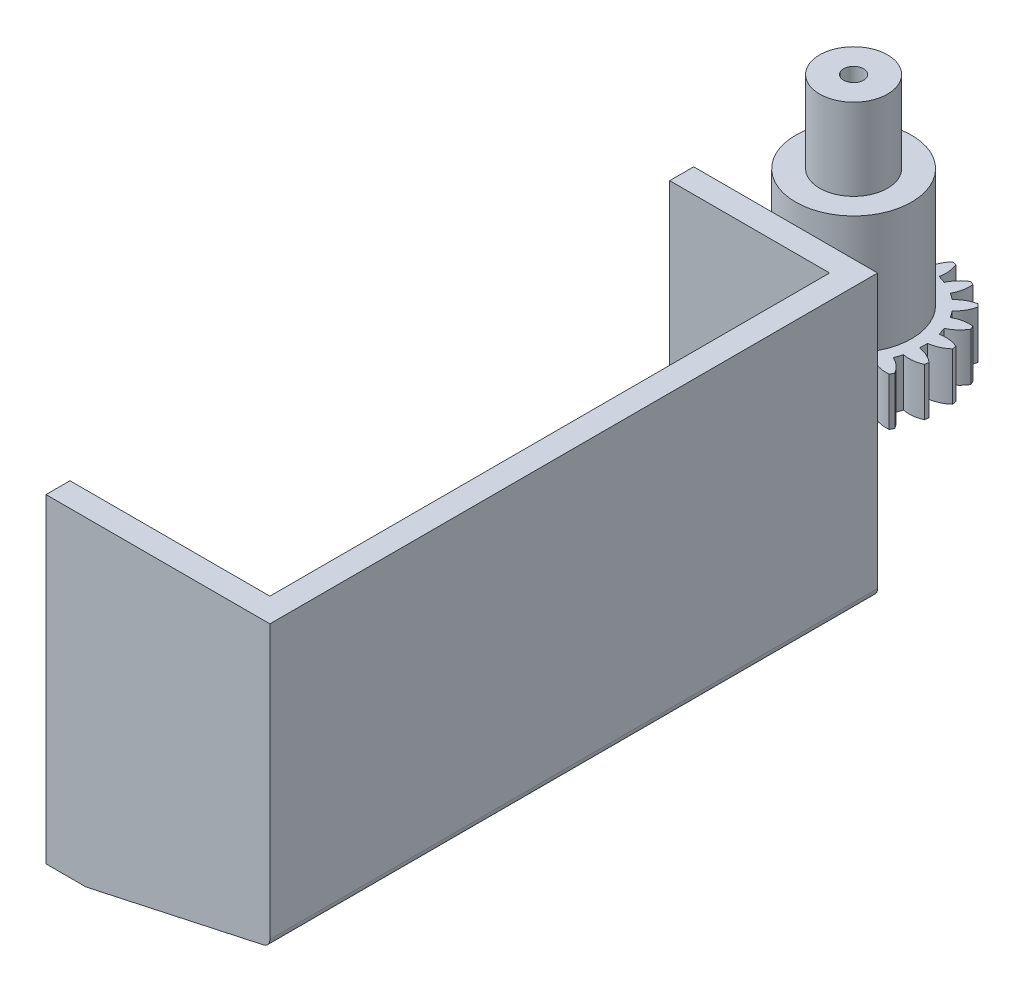
from build123d import *

# Parameters (mm, degrees)
EXTRUDE_1_DEPTH     = 6
EXTRUDE_2_DEPTH     = 20
EXTRUDE_4_DEPTH     = 6
SKETCH_5_R          = 7.25
EXTRUDE_5_DEPTH     = 14.8
SKETCH_6_R          = 4.25
SKETCH_6_R_2        = 1.25
EXTRUDE_6_DEPTH     = 10.2
EXTRUDE_7_DEPTH     = 76
CUT_EXTRUDE_1_DEPTH = 76


with BuildPart() as part:
    # 草图1 → 凸台-拉伸1 (new body)
    with BuildSketch(Plane(origin=(0, 0, 0), x_dir=(1, 0, 0), z_dir=(0, 1, 0))):
        with BuildLine():
            Line((-5, 0), (-5, -18))
            Line((-5, -18), (15, -18))
            Line((15, -18), (15, -88))
            Line((15, -88), (-10, -88))
            Line((-10, -88), (-10, -91))
            Line((-10, -91), (18, -91))
            Line((18, -91), (18, -15))
            Line((18, -15), (5, -15))
            Line((5, -15), (5, 0))
            ThreePointArc((5, 0), (0, 5), (-5, 0))
        make_face()
    extrude(amount=-EXTRUDE_1_DEPTH)

    # 草图2 → 凸台-拉伸2 (add, symmetric)
    with BuildSketch(Plane(origin=(0, 0, 0), x_dir=(1, 0, 0), z_dir=(0, 1, 0))):
        Polygon((-5, -18), (15, -18), (15, -88), (-10, -88), (-10, -91), (18, -91), (18, -15), (-5, -15), align=None)
    extrude(amount=EXTRUDE_2_DEPTH, both=True)

    # 草图4 → 凸台-拉伸4 (add)
    with BuildSketch(Plane.XZ.offset(6)):
        with BuildLine():
            ThreePointArc((-0.504732798, 8.734428762), (-0.823506466, 9.891100464), (-1.470958285, 10.901205517))
            ThreePointArc((-1.470958285, 10.901205517), (-1.726760313, 10.86362273), (-1.981608382, 10.820038273))
            ThreePointArc((-1.981608382, 10.820038273), (-2.283953757, 9.65896405), (-2.228374617, 8.460457882))
            ThreePointArc((-2.228374617, 8.460457882), (-2.708170263, 8.319303747), (-3.17911634, 8.150964378))
            ThreePointArc((-3.17911634, 8.150964378), (-3.839719327, 9.152518056), (-4.767622226, 9.913111434))
            ThreePointArc((-4.767622226, 9.913111434), (-4.999290692, 9.798320906), (-5.228197271, 9.678117239))
            ThreePointArc((-5.228197271, 9.678117239), (-5.156953143, 8.480440175), (-4.733735466, 7.357767973))
            ThreePointArc((-4.733735466, 7.357767973), (-5.146429214, 7.075257405), (-5.542305825, 6.76962681))
            ThreePointArc((-5.542305825, 6.76962681), (-6.480073708, 7.518023412), (-7.597598086, 7.954652936))
            ThreePointArc((-7.597598086, 7.954652936), (-7.782455665, 7.773891163), (-7.963013783, 7.588834659))
            ThreePointArc((-7.963013783, 7.588834659), (-7.525154025, 6.471791729), (-6.775725305, 5.53484847))
            ThreePointArc((-6.775725305, 5.53484847), (-7.080919818, 5.138635571), (-7.3629758, 4.725631002))
            ThreePointArc((-7.3629758, 4.725631002), (-8.486113324, 5.147612255), (-9.683868109, 5.217537585))
            ThreePointArc((-9.683868109, 5.217537585), (-9.803819655, 4.988498789), (-9.918355025, 4.756704069))
            ThreePointArc((-9.918355025, 4.756704069), (-9.1567404, 3.829639217), (-8.154459943, 3.170139435))
            ThreePointArc((-8.154459943, 3.170139435), (-8.322280653, 2.699008286), (-8.462906403, 2.219057507))
            ThreePointArc((-8.462906403, 2.219057507), (-9.661473042, 2.273316945), (-10.82221365, 1.969693302))
            ThreePointArc((-10.82221365, 1.969693302), (-10.86551747, 1.714797397), (-10.902818572, 1.458954141))
            ThreePointArc((-10.902818572, 1.458954141), (-9.892001226, 0.812614936), (-8.734979226, 0.495115065))
            ThreePointArc((-8.734979226, 0.495115065), (-8.748998674, -0.004816736), (-8.734428762, -0.504732798))
            ThreePointArc((-8.734428762, -0.504732798), (-9.891100464, -0.823506466), (-10.901205517, -1.470958285))
            ThreePointArc((-10.901205517, -1.470958285), (-10.86362273, -1.726760313), (-10.820038273, -1.981608382))
            ThreePointArc((-10.820038273, -1.981608382), (-9.65896405, -2.283953757), (-8.460457882, -2.228374617))
            ThreePointArc((-8.460457882, -2.228374617), (-8.319303747, -2.708170263), (-8.150964378, -3.17911634))
            ThreePointArc((-8.150964378, -3.17911634), (-9.152518056, -3.839719327), (-9.913111434, -4.767622226))
            ThreePointArc((-9.913111434, -4.767622226), (-9.798320906, -4.999290692), (-9.678117239, -5.228197271))
            ThreePointArc((-9.678117239, -5.228197271), (-8.480440175, -5.156953143), (-7.357767973, -4.733735466))
            ThreePointArc((-7.357767973, -4.733735466), (-7.075257405, -5.146429214), (-6.76962681, -5.542305825))
            ThreePointArc((-6.76962681, -5.542305825), (-7.518023412, -6.480073708), (-7.954652936, -7.597598086))
            ThreePointArc((-7.954652936, -7.597598086), (-7.773891163, -7.782455665), (-7.588834659, -7.963013783))
            ThreePointArc((-7.588834659, -7.963013783), (-6.471791729, -7.525154025), (-5.53484847, -6.775725305))
            ThreePointArc((-5.53484847, -6.775725305), (-5.138635571, -7.080919818), (-4.725631002, -7.3629758))
            ThreePointArc((-4.725631002, -7.3629758), (-5.147612255, -8.486113324), (-5.217537585, -9.683868109))
            ThreePointArc((-5.217537585, -9.683868109), (-4.988498789, -9.803819655), (-4.756704069, -9.918355025))
            ThreePointArc((-4.756704069, -9.918355025), (-3.829639217, -9.1567404), (-3.170139435, -8.154459943))
            ThreePointArc((-3.170139435, -8.154459943), (-2.699008286, -8.322280653), (-2.219057507, -8.462906403))
            ThreePointArc((-2.219057507, -8.462906403), (-2.273316945, -9.661473042), (-1.969693302, -10.82221365))
            ThreePointArc((-1.969693302, -10.82221365), (-1.714797397, -10.86551747), (-1.458954141, -10.902818572))
            ThreePointArc((-1.458954141, -10.902818572), (-0.812614936, -9.892001226), (-0.495115065, -8.734979226))
            ThreePointArc((-0.495115065, -8.734979226), (0.004816736, -8.748998674), (0.504732798, -8.734428762))
            ThreePointArc((0.504732798, -8.734428762), (0.823506466, -9.891100464), (1.470958285, -10.901205517))
            ThreePointArc((1.470958285, -10.901205517), (1.726760313, -10.86362273), (1.981608382, -10.820038273))
            ThreePointArc((1.981608382, -10.820038273), (2.283953757, -9.65896405), (2.228374617, -8.460457882))
            ThreePointArc((2.228374617, -8.460457882), (2.708170263, -8.319303747), (3.17911634, -8.150964378))
            ThreePointArc((3.17911634, -8.150964378), (3.839719327, -9.152518056), (4.767622226, -9.913111434))
            ThreePointArc((4.767622226, -9.913111434), (4.999290692, -9.798320906), (5.228197271, -9.678117239))
            ThreePointArc((5.228197271, -9.678117239), (5.156953143, -8.480440175), (4.733735466, -7.357767973))
            ThreePointArc((4.733735466, -7.357767973), (5.146429214, -7.075257405), (5.542305825, -6.76962681))
            ThreePointArc((5.542305825, -6.76962681), (6.480073708, -7.518023412), (7.597598086, -7.954652936))
            ThreePointArc((7.597598086, -7.954652936), (7.782455665, -7.773891163), (7.963013783, -7.588834659))
            ThreePointArc((7.963013783, -7.588834659), (7.525154025, -6.471791729), (6.775725305, -5.53484847))
            ThreePointArc((6.775725305, -5.53484847), (7.080919818, -5.138635571), (7.3629758, -4.725631002))
            ThreePointArc((7.3629758, -4.725631002), (8.486113324, -5.147612255), (9.683868109, -5.217537585))
            ThreePointArc((9.683868109, -5.217537585), (9.803819655, -4.988498789), (9.918355025, -4.756704069))
            ThreePointArc((9.918355025, -4.756704069), (9.1567404, -3.829639217), (8.154459943, -3.170139435))
            ThreePointArc((8.154459943, -3.170139435), (8.322280653, -2.699008286), (8.462906403, -2.219057507))
            ThreePointArc((8.462906403, -2.219057507), (9.661473042, -2.273316945), (10.82221365, -1.969693302))
            ThreePointArc((10.82221365, -1.969693302), (10.86551747, -1.714797397), (10.902818572, -1.458954141))
            ThreePointArc((10.902818572, -1.458954141), (9.892001226, -0.812614936), (8.734979226, -0.495115065))
            ThreePointArc((8.734979226, -0.495115065), (8.748998674, 0.004816736), (8.734428762, 0.504732798))
            ThreePointArc((8.734428762, 0.504732798), (9.891100464, 0.823506466), (10.901205517, 1.470958285))
            ThreePointArc((10.901205517, 1.470958285), (10.86362273, 1.726760313), (10.820038273, 1.981608382))
            ThreePointArc((10.820038273, 1.981608382), (9.65896405, 2.283953757), (8.460457882, 2.228374617))
            ThreePointArc((8.460457882, 2.228374617), (8.319303747, 2.708170263), (8.150964378, 3.17911634))
            ThreePointArc((8.150964378, 3.17911634), (9.152518056, 3.839719327), (9.913111434, 4.767622226))
            ThreePointArc((9.913111434, 4.767622226), (9.798320906, 4.999290692), (9.678117239, 5.228197271))
            ThreePointArc((9.678117239, 5.228197271), (8.480440175, 5.156953143), (7.357767973, 4.733735466))
            ThreePointArc((7.357767973, 4.733735466), (7.075257405, 5.146429214), (6.76962681, 5.542305825))
            ThreePointArc((6.76962681, 5.542305825), (7.518023412, 6.480073708), (7.954652936, 7.597598086))
            ThreePointArc((7.954652936, 7.597598086), (7.773891163, 7.782455665), (7.588834659, 7.963013783))
            ThreePointArc((7.588834659, 7.963013783), (6.471791729, 7.525154025), (5.53484847, 6.775725305))
            ThreePointArc((5.53484847, 6.775725305), (5.138635571, 7.080919818), (4.725631002, 7.3629758))
            ThreePointArc((4.725631002, 7.3629758), (5.147612255, 8.486113324), (5.217537585, 9.683868109))
            ThreePointArc((5.217537585, 9.683868109), (4.988498789, 9.803819655), (4.756704069, 9.918355025))
            ThreePointArc((4.756704069, 9.918355025), (3.829639217, 9.1567404), (3.170139435, 8.154459943))
            ThreePointArc((3.170139435, 8.154459943), (2.699008286, 8.322280653), (2.219057507, 8.462906403))
            ThreePointArc((2.219057507, 8.462906403), (2.273316945, 9.661473042), (1.969693302, 10.82221365))
            ThreePointArc((1.969693302, 10.82221365), (1.714797397, 10.86551747), (1.458954141, 10.902818572))
            ThreePointArc((1.458954141, 10.902818572), (0.812614936, 9.892001226), (0.495115065, 8.734979226))
            ThreePointArc((0.495115065, 8.734979226), (-0.004816736, 8.748998674), (-0.504732798, 8.734428762))
        make_face()
    extrude(amount=-EXTRUDE_4_DEPTH)

    # 草图5 → 凸台-拉伸5 (add)
    with BuildSketch(Plane(origin=(0, 0, 0), x_dir=(1, 0, 0), z_dir=(0, 1, 0))):
        with Locations(Location((0, 0, 0), (0, 0, 270))):
            Circle(SKETCH_5_R)
    extrude(amount=EXTRUDE_5_DEPTH)

    # 草图6 → 凸台-拉伸6 (add)
    with BuildSketch(Plane(origin=(0, 14.8, 0), x_dir=(1, 0, 0), z_dir=(0, 1, 0))):
        with Locations(Location((0, 0, 0), (0, 0, 270))):
            Circle(SKETCH_6_R)
        with Locations(Location((0, 0, 0), (0, 0, 270))):
            Circle(SKETCH_6_R_2, mode=Mode.SUBTRACT)
    extrude(amount=EXTRUDE_6_DEPTH)

    # 草图8 → 凸台-拉伸7 (add)
    with BuildSketch(Plane.XY.offset(91)):
        Polygon((-10, -20), (18, -10), (18, -20), align=None)
    extrude(amount=-EXTRUDE_7_DEPTH)

    # 草图9 → 切除-拉伸1 (cut)
    with BuildSketch(Plane(origin=(0, 0, 15), x_dir=(-1, 0, 0), z_dir=(0, 0, -1))):
        with BuildLine():
            Line((4.895011274, -19.977176364), (-17.212429644, -15.171210947))
            ThreePointArc((-17.212429644, -15.171210947), (-17.778597985, -14.821557633), (-18, -14.194034583))
            Line((-18, -14.194034583), (-18, -20))
            Line((-18, -20), (5.107440918, -20))
            ThreePointArc((5.107440918, -20), (5.000614807, -19.994277719), (4.895011274, -19.977176364))
        make_face()
    extrude(amount=-CUT_EXTRUDE_1_DEPTH, mode=Mode.SUBTRACT)


solid = part.part
